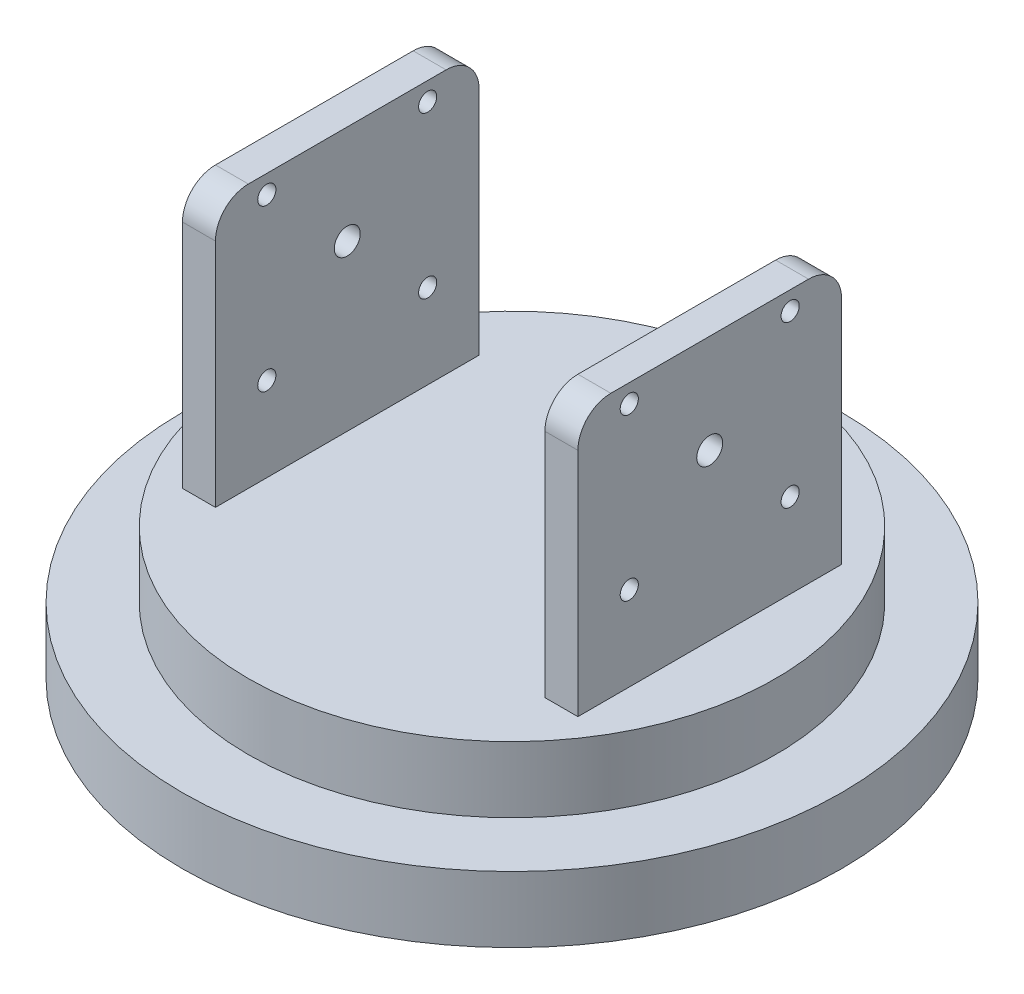
from build123d import *

# Parameters (mm, degrees)
SKETCH2_R           = 63.5
BOSS_EXTRUDE1_DEPTH = 12.7
SKETCH3_R           = 50.8
BOSS_EXTRUDE2_DEPTH = 12.7
SKETCH4_R           = 6.35
BOSS_EXTRUDE3_DEPTH = 25.4
SKETCH5_W           = 6.35
SKETCH5_H           = 50.8
BOSS_EXTRUDE4_DEPTH = 50.8
FILLET1_R           = 6.35
SKETCH6_R           = 2.5019
SKETCH6_R_2         = 1.75
CUT_EXTRUDE1_DEPTH  = 142.990316571
CUT_EXTRUDE2_START  = -12.7
CUT_EXTRUDE2_DEPTH  = 12.7
CIRPATTERN1_COUNT   = 28


with BuildPart() as part:
    # Sketch2 → Boss-Extrude1 (new body)
    with BuildSketch(Plane(origin=(0, 0, 0), x_dir=(1, 0, 0), z_dir=(0, 1, 0))):
        with Locations(Location((0, 0, 0), (0, 0, 270))):
            Circle(SKETCH2_R)
    extrude(amount=BOSS_EXTRUDE1_DEPTH)

    # Sketch3 → Boss-Extrude2 (add)
    with BuildSketch(Plane(origin=(0, 12.7, 0), x_dir=(1, 0, 0), z_dir=(0, 1, 0))):
        with Locations(Location((0, 0, 0), (0, 0, 270))):
            Circle(SKETCH3_R)
    extrude(amount=BOSS_EXTRUDE2_DEPTH)

    # Sketch4 → Boss-Extrude3 (add)
    with BuildSketch(Plane.XZ):
        with Locations(Location((0, 0, 0), (0, 0, 90))):
            Circle(SKETCH4_R)
    extrude(amount=BOSS_EXTRUDE3_DEPTH)

    # Sketch5 → Boss-Extrude4 (add)
    with BuildSketch(Plane(origin=(0, 25.4, 0), x_dir=(1, 0, 0), z_dir=(0, 1, 0))):
        with Locations((34.925, 0)):
            Rectangle(SKETCH5_W, SKETCH5_H)
        with Locations((-34.925, 0)):
            Rectangle(SKETCH5_W, SKETCH5_H)
    extrude(amount=BOSS_EXTRUDE4_DEPTH)

    # Fillet1
    fillet1_edges = [part.edges().sort_by_distance(p)[0] for p in [
        (-34.925, 76.2, 25.4),
        (-34.925, 76.2, -25.4),
        (34.925, 76.2, -25.4),
        (34.925, 76.2, 25.4),
    ]]
    fillet(fillet1_edges, radius=FILLET1_R)

    # Sketch6 → Cut-Extrude1 (cut, through all)
    with BuildSketch(Plane.ZY.offset(38.1)):
        with Locations((0, 57.15)):
            Circle(SKETCH6_R)
        with Locations((-15.5, 41.65)):
            Circle(SKETCH6_R_2)
        with Locations((15.499999976, 41.65)):
            Circle(SKETCH6_R_2)
        with Locations((15.499999976, 72.649999976)):
            Circle(SKETCH6_R_2)
        with Locations((-15.5, 72.649999976)):
            Circle(SKETCH6_R_2)
    extrude(amount=-CUT_EXTRUDE1_DEPTH, mode=Mode.SUBTRACT)

    # Sketch7 → Cut-Extrude2 (cut)
    with BuildSketch(Plane.XZ.offset(25.4).offset(CUT_EXTRUDE2_START)):
        with BuildLine():
            Line((0, 5.08), (0.710231041, 6.310156248))
            ThreePointArc((0.710231041, 6.310156248), (0, 6.35), (-0.710231041, 6.310156248))
            Line((-0.710231041, 6.310156248), (0, 5.08))
        make_face()
    cut_extrude2 = extrude(amount=CUT_EXTRUDE2_DEPTH, mode=Mode.SUBTRACT)

    # CirPattern1: Cut-Extrude2 ×28 about axis
    cirpattern1_axis = Axis((0, 0, 0), (0, 1, 0))
    for i in range(1, CIRPATTERN1_COUNT):
        add(cut_extrude2.rotate(cirpattern1_axis, i * 360 / CIRPATTERN1_COUNT), mode=Mode.SUBTRACT)


solid = part.part
